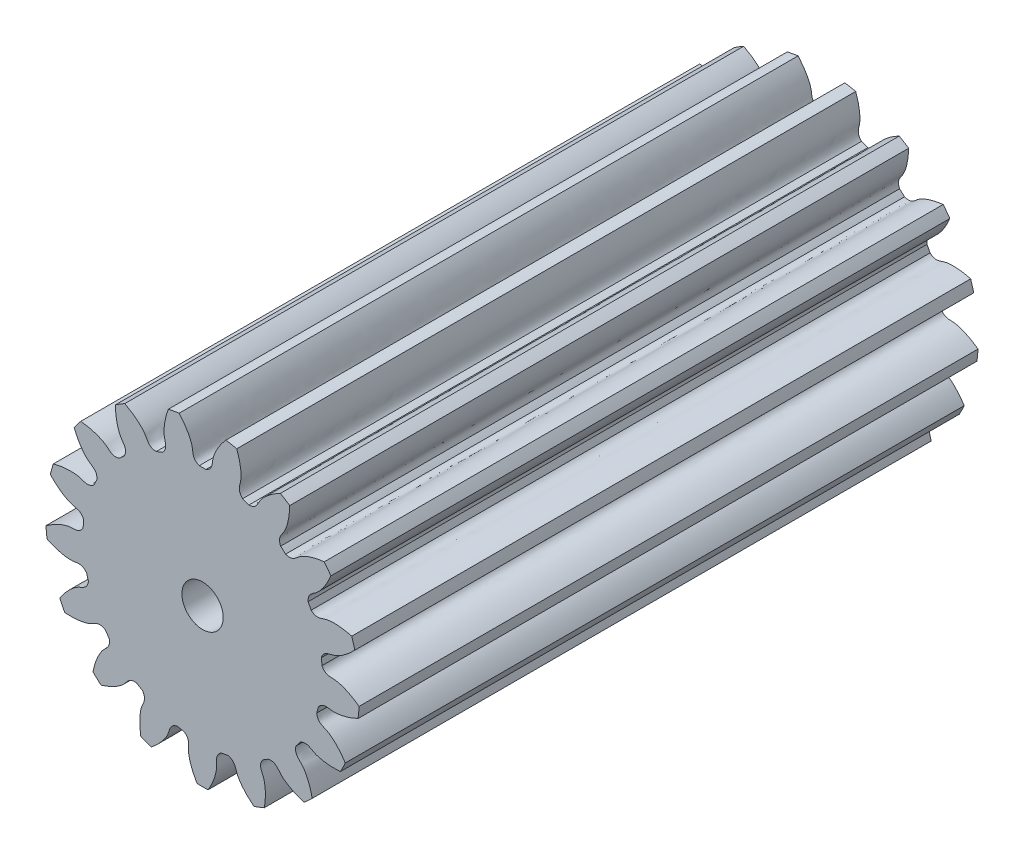
from build123d import *

# Parameters (mm, degrees)
SKETCH_1_R               = 7.6
EXTRUDE_1_DEPTH          = 30
CUT_EXTRUDE_1_DEPTH      = 32.867224542
PATTERN_CIRCULAR_1_COUNT = 17
SKETCH_5_R               = 1
CUT_EXTRUDE_2_DEPTH      = 32.864282309


with BuildPart() as part:
    # 草图1 → 凸台-拉伸1 (new body)
    with BuildSketch(Plane.XY):
        Circle(SKETCH_1_R)
    extrude(amount=EXTRUDE_1_DEPTH)

    # 草图2 → 切除-拉伸1 (cut, through all)
    with BuildSketch(Plane.XY):
        with BuildLine():
            ThreePointArc((0.161354998, 5.797755131), (0, 5.8), (-0.161354998, 5.797755131))
            add(Edge.make_bspline(
                [(-0.161354998, 5.797755131), (-0.502303792, 5.939857617), (-0.452956302, 6.203850725), (-0.510644484, 6.45185931), (-0.515980588, 6.472920476), (-0.522414802, 6.496335451), (-0.530040472, 6.522068266), (-0.538953422, 6.550079491), (-0.549247264, 6.580327006), (-0.561014756, 6.612765801), (-0.574347289, 6.647348075), (-0.589334943, 6.684023251), (-0.606066371, 6.722738016), (-0.624628742, 6.763436353), (-0.645107661, 6.806059585), (-0.6675871, 6.850546412), (-0.692149329, 6.896832956), (-0.718874844, 6.9448528), (-0.7478423, 6.99453704), (-0.779128444, 7.045814328), (-0.812808046, 7.098610923), (-0.84895384, 7.152850742), (-0.887636455, 7.20845541), (-0.928924356, 7.265344316), (-0.972883781, 7.323434671), (-1.019578682, 7.382641559), (-1.069070668, 7.442878002), (-1.121418947, 7.504055015), (-1.17668027, 7.566081672), (-1.23490888, 7.628865164), (-1.296156456, 7.692310868), (-1.360472066, 7.75632241), (-1.427902117, 7.820801735), (-1.498490303, 7.885649168), (-1.572277567, 7.950763492), (-1.649302052, 8.016042015), (-1.72959906, 8.08138064), (-1.813201009, 8.146673939), (-1.900137399, 8.211815229), (-1.990434771, 8.276696645), (-2.084116678, 8.341209215), (-2.181203627, 8.40524294), (-2.316657308, 8.490744427), (-2.421261522, 8.552420777), (-2.492516667, 8.592575295)],
                knots=[0, 0, 0, 0, 0.193882922, 0.199023975, 0.204850501, 0.211362501, 0.218559975, 0.226442923, 0.235011345, 0.24426524, 0.254204608, 0.264829451, 0.276139767, 0.288135557, 0.300816821, 0.314183558, 0.328235769, 0.342973453, 0.358396612, 0.374505244, 0.39129935, 0.408778929, 0.426943982, 0.445794509, 0.46533051, 0.485551984, 0.506458932, 0.528051354, 0.550329249, 0.573292619, 0.596941461, 0.621275778, 0.646295568, 0.672000832, 0.69839157, 0.725467781, 0.753229466, 0.781676625, 0.810809257, 0.840627364, 0.871130943, 0.902319997, 0.934194524, 1, 1, 1, 1], degree=3))
            ThreePointArc((-2.492516667, 8.592575295), (0, 8.946786548), (2.492516667, 8.592575295))
            add(Edge.make_bspline(
                [(0.161354998, 5.797755131), (0.502303792, 5.939857617), (0.452956302, 6.203850725), (0.510644484, 6.45185931), (0.515980588, 6.472920476), (0.522414802, 6.496335451), (0.530040472, 6.522068266), (0.538953422, 6.550079491), (0.549247264, 6.580327006), (0.561014756, 6.612765801), (0.574347289, 6.647348075), (0.589334943, 6.684023251), (0.606066371, 6.722738016), (0.624628742, 6.763436353), (0.645107661, 6.806059585), (0.6675871, 6.850546412), (0.692149329, 6.896832956), (0.718874844, 6.9448528), (0.7478423, 6.99453704), (0.779128444, 7.045814328), (0.812808046, 7.098610923), (0.84895384, 7.152850742), (0.887636455, 7.20845541), (0.928924356, 7.265344316), (0.972883781, 7.323434671), (1.019578682, 7.382641559), (1.069070668, 7.442878002), (1.121418947, 7.504055015), (1.17668027, 7.566081672), (1.23490888, 7.628865164), (1.296156456, 7.692310868), (1.360472066, 7.75632241), (1.427902117, 7.820801735), (1.498490303, 7.885649168), (1.572277567, 7.950763492), (1.649302052, 8.016042015), (1.72959906, 8.08138064), (1.813201009, 8.146673939), (1.900137399, 8.211815229), (1.990434771, 8.276696645), (2.084116678, 8.341209215), (2.181203627, 8.40524294), (2.316657308, 8.490744427), (2.421261522, 8.552420777), (2.492516667, 8.592575295)],
                knots=[0, 0, 0, 0, 0.193882922, 0.199023975, 0.204850501, 0.211362501, 0.218559975, 0.226442923, 0.235011345, 0.24426524, 0.254204608, 0.264829451, 0.276139767, 0.288135557, 0.300816821, 0.314183558, 0.328235769, 0.342973453, 0.358396612, 0.374505244, 0.39129935, 0.408778929, 0.426943982, 0.445794509, 0.46533051, 0.485551984, 0.506458932, 0.528051354, 0.550329249, 0.573292619, 0.596941461, 0.621275778, 0.646295568, 0.672000832, 0.69839157, 0.725467781, 0.753229466, 0.781676625, 0.810809257, 0.840627364, 0.871130943, 0.902319997, 0.934194524, 1, 1, 1, 1], degree=3))
        make_face()
    cut_extrude_1 = extrude(amount=CUT_EXTRUDE_1_DEPTH, mode=Mode.SUBTRACT)

    # 阵列(圆周)1: 切除-拉伸1 ×17 about axis
    pattern_circular_1_axis = Axis((0, 0, -5.30009942), (0, 0, 1))
    for i in range(1, PATTERN_CIRCULAR_1_COUNT):
        add(cut_extrude_1.rotate(pattern_circular_1_axis, i * 360 / PATTERN_CIRCULAR_1_COUNT), mode=Mode.SUBTRACT)

    # 草图5 → 切除-拉伸2 (cut, through all)
    with BuildSketch(Plane(origin=(0, 0, 0), x_dir=(-1, 0, 0), z_dir=(0, 0, -1))):
        Circle(SKETCH_5_R)
    extrude(amount=-CUT_EXTRUDE_2_DEPTH, mode=Mode.SUBTRACT)


solid = part.part
